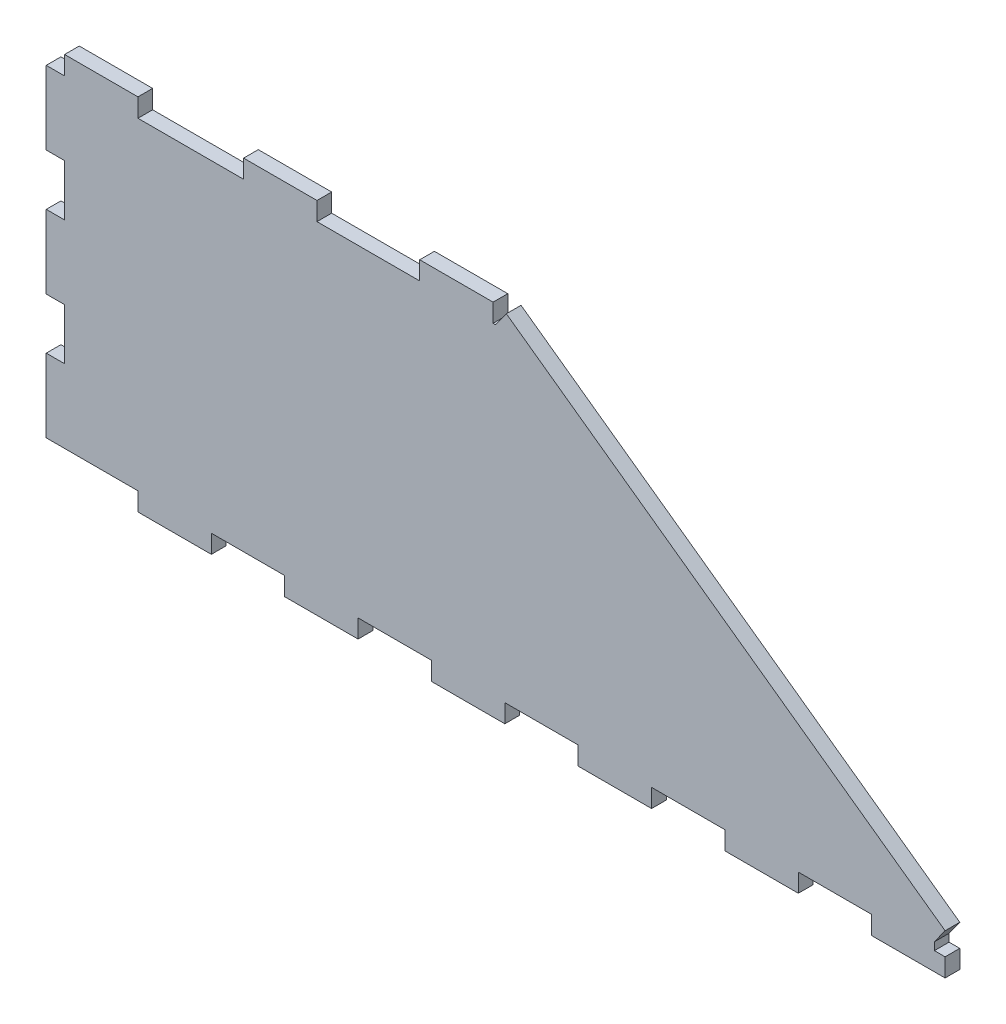
from build123d import *

# Parameters (mm, degrees)
BOSS_EXTRUDE1_DEPTH = 5.08


with BuildPart() as part:
    # Sketch1 → Boss-Extrude1 (new body)
    with BuildSketch(Plane(origin=(-5.329574036, -16.20301374, 0), x_dir=(1, 0, 0), z_dir=(0, 0, 1))):
        Polygon((-288.637525151, -47.206627274), (-294.987525151, -47.206627274), (-294.987525151, -72.606627274), (-288.637525151, -72.606627274), (-288.637525151, -90.386627274), (-294.987525151, -90.386627274), (-294.987525151, -115.786627274), (-288.637525151, -115.786627274), (-288.637525151, -133.491124316), (-294.987525151, -133.491124316), (-294.987525151, -158.891124316), (-263.237525151, -158.891124316), (-263.237525151, -165.241124316), (-237.837525151, -165.241124316), (-237.837525151, -158.891124316), (-212.437525151, -158.891124316), (-212.437525151, -165.241124316), (-187.037525151, -165.241124316), (-187.037525151, -158.891124316), (-161.637525151, -158.891124316), (-161.637525151, -165.241124316), (-136.237525151, -165.241124316), (-136.237525151, -158.891124316), (-110.837525151, -158.891124316), (-110.837525151, -165.241124316), (-85.437525151, -165.241124316), (-85.437525151, -158.891124316), (-60.037525151, -158.891124316), (-60.037525151, -165.241124316), (-34.637525151, -165.241124316), (-34.637525151, -158.891124316), (-9.237525151, -158.891124316), (-9.237525151, -165.241124316), (16.162474849, -165.241124316), (16.162474849, -158.891124316), (12.459338773, -158.891124316), (12.459338773, -156.232709467), (16.162474849, -151.074290795), (-135.709389075, -42.048208602), (-139.412525151, -47.206627274), (-140.301525151, -47.206627274), (-140.301525151, -40.856627274), (-165.701525151, -40.856627274), (-165.701525151, -47.206627274), (-201.261525151, -47.206627274), (-201.261525151, -40.856627274), (-226.661525151, -40.856627274), (-226.661525151, -47.206627274), (-263.237525151, -47.206627274), (-263.237525151, -40.781124316), (-288.637525151, -40.781124316), align=None)
    extrude(amount=BOSS_EXTRUDE1_DEPTH)


solid = part.part
